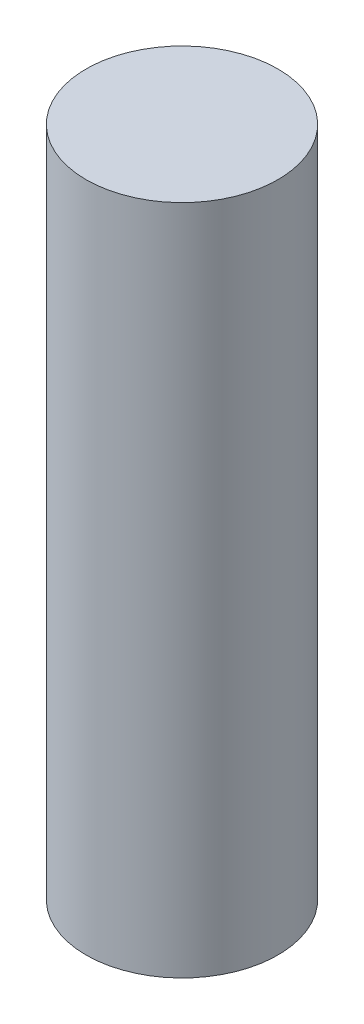
from build123d import *

# Parameters (mm, degrees)
SKETCH1_R           = 3
BOSS_EXTRUDE1_DEPTH = 21


with BuildPart() as part:
    # Sketch1 → Boss-Extrude1 (new body)
    with BuildSketch(Plane(origin=(0, 0, 0), x_dir=(1, 0, 0), z_dir=(0, 1, 0))):
        with Locations(Location((0, 0, 0), (0, 0, 90))):
            Circle(SKETCH1_R)
    extrude(amount=BOSS_EXTRUDE1_DEPTH)


solid = part.part
